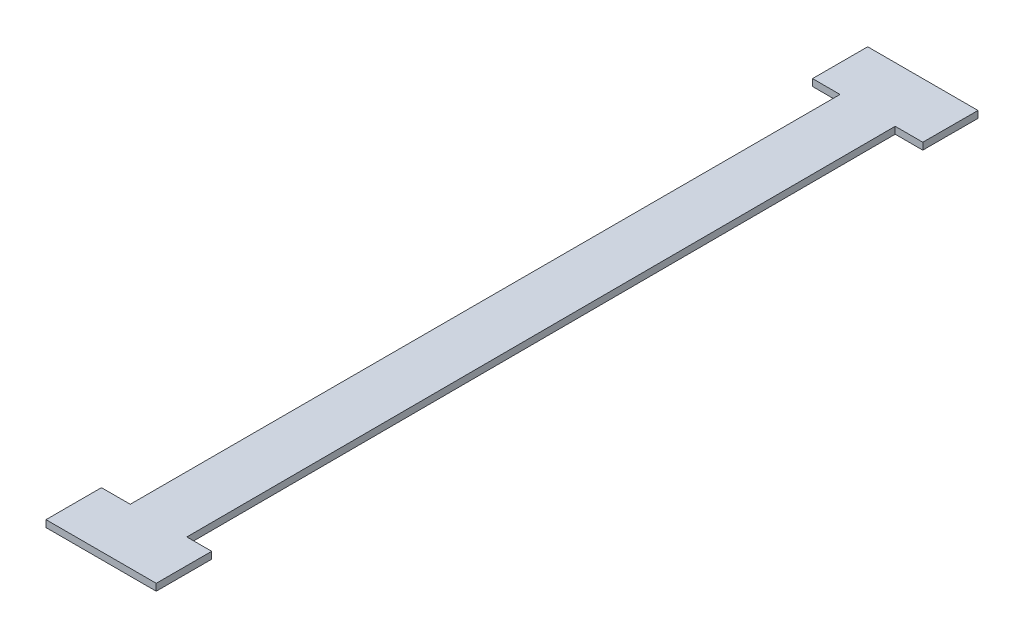
from build123d import *

# Parameters (mm, degrees)
BOSS_EXTRUDE1_DEPTH = 3.175


with BuildPart() as part:
    # Sketch1 → Boss-Extrude1 (new body)
    with BuildSketch(Plane(origin=(0, 0, 0), x_dir=(1, 0, 0), z_dir=(0, 1, 0))):
        Polygon((-0.057457164, 357.286405716), (-12.72218241, 357.286405716), (-12.72218241, 382.672528004), (38.084155299, 382.672528004), (38.041083739, 357.286405716), (25.327570208, 357.286405716), (26.011374652, 30.397302739), (37.443141483, 30.397302739), (37.443141483, 4.862775301), (-13.319438006, 4.862775301), (-13.319438006, 30.397302739), (-0.057457164, 30.397302739), align=None)
    extrude(amount=BOSS_EXTRUDE1_DEPTH)


solid = part.part
